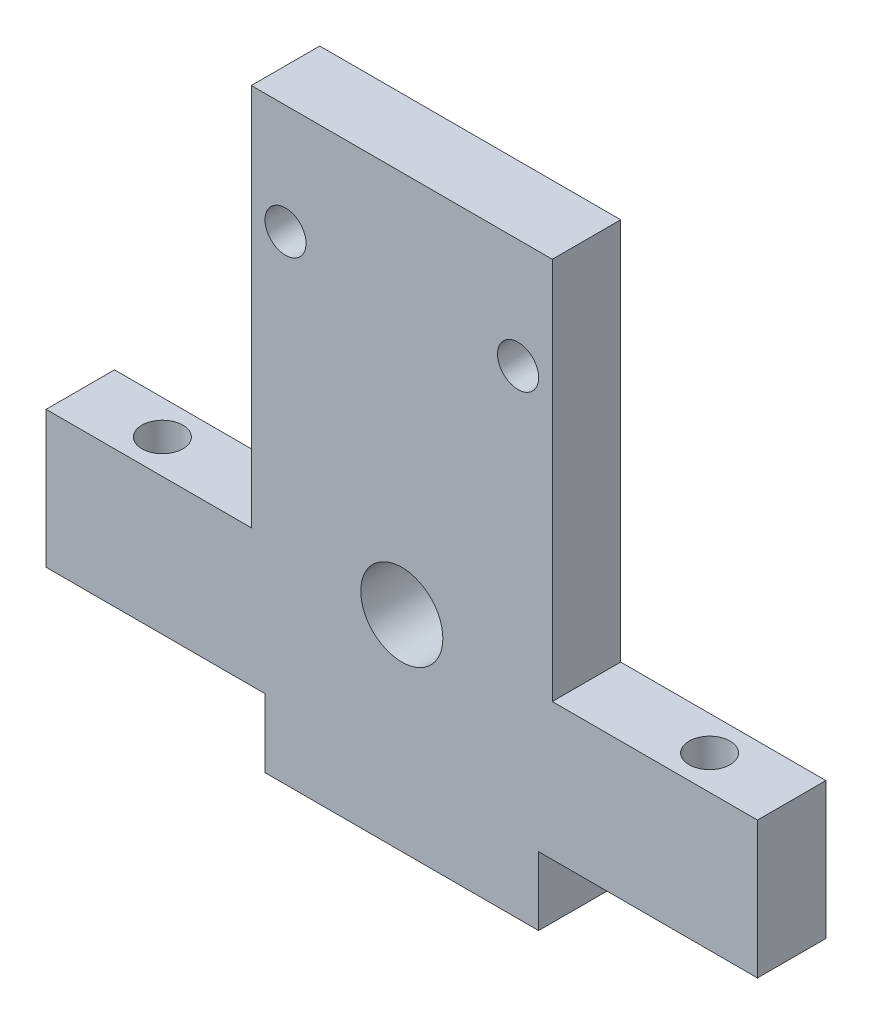
from build123d import *

# Parameters (mm, degrees)
SKETCH1_R           = 3
SKETCH1_R_2         = 1.5
BOSS_EXTRUDE1_DEPTH = 5
SKETCH2_R           = 1.5
CUT_EXTRUDE1_DEPTH  = 10
SKETCH2_3_R         = 1.5
CUT_EXTRUDE2_DEPTH  = 10


with BuildPart() as part:
    # Sketch1 → Boss-Extrude1 (new body)
    with BuildSketch(Plane.XY):
        Polygon((12.083913986, -6.170151075), (12.083913986, 21.829848925), (-9.916086014, 21.829848925), (-9.916086014, -6.170151075), (-24.916086014, -6.170151075), (-24.916086014, -16.170151075), (-8.916086014, -16.170151075), (-8.916086014, -21.170151075), (11.083913986, -21.170151075), (11.083913986, -16.170151075), (27.083913986, -16.170151075), (27.083913986, -6.170151075), align=None)
        with Locations((1.083913986, -6.170151075)):
            Circle(SKETCH1_R, mode=Mode.SUBTRACT)
        with Locations((-7.416086014, 13.829848925)):
            Circle(SKETCH1_R_2, mode=Mode.SUBTRACT)
        with Locations((9.583913986, 13.829848925)):
            Circle(SKETCH1_R_2, mode=Mode.SUBTRACT)
    extrude(amount=BOSS_EXTRUDE1_DEPTH)

    # Sketch2 → Cut-Extrude1 (cut)
    with BuildSketch(Plane(origin=(0, -6.170151075, 0), x_dir=(1, 0, 0), z_dir=(0, 1, 0))):
        with Locations((-18.916086014, -2.5)):
            Circle(SKETCH2_R)
    extrude(amount=-CUT_EXTRUDE1_DEPTH, mode=Mode.SUBTRACT)

    # Sketch2<3> → Cut-Extrude2 (cut)
    with BuildSketch(Plane(origin=(0, -6.170151075, 0), x_dir=(1, 0, 0), z_dir=(0, 1, 0))):
        with Locations((-18.916086014, -2.5)):
            Circle(SKETCH2_3_R)
        with Locations((21.083913986, -2.5)):
            Circle(SKETCH2_3_R)
    extrude(amount=-CUT_EXTRUDE2_DEPTH, mode=Mode.SUBTRACT)


solid = part.part
